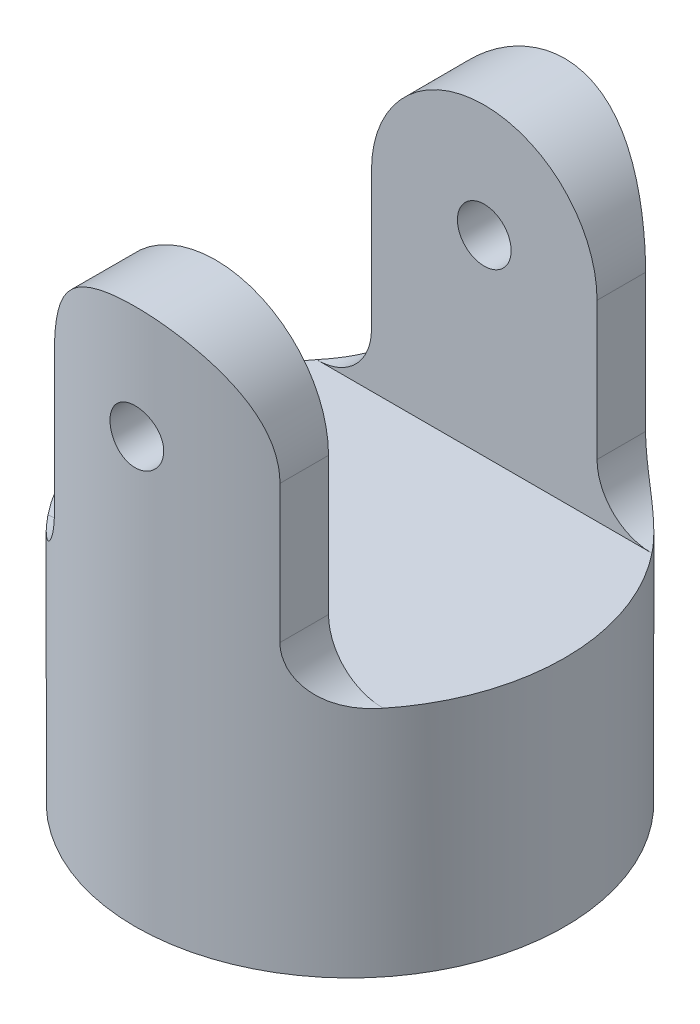
from build123d import *

# Parameters (mm, degrees)
SKETCH1_R               = 6
BOSS_EXTRUDE1_DEPTH     = 15
CUT_EXTRUDE1_DEPTH      = 18.23368794
CUT_EXTRUDE1_DEPTH_BACK = 18.23368794
SKETCH2_W               = 7.5
SKETCH2_H               = 8.5
CUT_EXTRUDE2_DEPTH      = 18.23368794
CUT_EXTRUDE2_DEPTH_BACK = 18.23368794
SKETCH3_R               = 0.75


with BuildPart() as part:
    # Sketch1 → Boss-Extrude1 (new body)
    with BuildSketch(Plane(origin=(0, 0, 0), x_dir=(1, 0, 0), z_dir=(0, 1, 0))):
        with Locations(Location((0, 0, 0), (0, 0, 270))):
            Circle(SKETCH1_R)
    extrude(amount=BOSS_EXTRUDE1_DEPTH)

    # Sketch2 → Cut-Extrude1 (cut, two sides: drawn at the far end of the back side and taken through both)
    with BuildSketch(Plane(origin=(0, 0, 0), x_dir=(0, 0, -1), z_dir=(1, 0, 0)).offset(-CUT_EXTRUDE1_DEPTH_BACK)):
        with Locations((0, 10.75)):
            Rectangle(SKETCH2_W, SKETCH2_H)
    extrude(amount=CUT_EXTRUDE1_DEPTH + CUT_EXTRUDE1_DEPTH_BACK, mode=Mode.SUBTRACT)

    # Sketch3 → Cut-Extrude2 (cut, two sides: drawn at the far end of the back side and taken through both)
    with BuildSketch(Plane.XY.offset(-CUT_EXTRUDE2_DEPTH_BACK)):
        with BuildLine():
            Line((-3.15, 8), (-3.15, 11.85))
            ThreePointArc((-3.15, 11.85), (-2.227386361, 14.077386361), (0, 15))
            Line((0, 15), (-4.683748499, 15))
            Line((-4.683748499, 15), (-4.683748499, 6.5))
            Line((-4.683748499, 6.5), (-4.65, 6.5))
            ThreePointArc((-4.65, 6.5), (-3.589339828, 6.939339828), (-3.15, 8))
        make_face()
        with BuildLine():
            Line((4.683748499, 15), (0, 15))
            ThreePointArc((0, 15), (2.227386361, 14.077386361), (3.15, 11.85))
            Line((3.15, 11.85), (3.15, 8))
            ThreePointArc((3.15, 8), (3.589339828, 6.939339828), (4.65, 6.5))
            Line((4.65, 6.5), (4.683748499, 6.5))
            Line((4.683748499, 6.5), (4.683748499, 15))
        make_face()
        with Locations((0, 11.85)):
            Circle(SKETCH3_R)
    extrude(amount=CUT_EXTRUDE2_DEPTH + CUT_EXTRUDE2_DEPTH_BACK, mode=Mode.SUBTRACT)


solid = part.part
